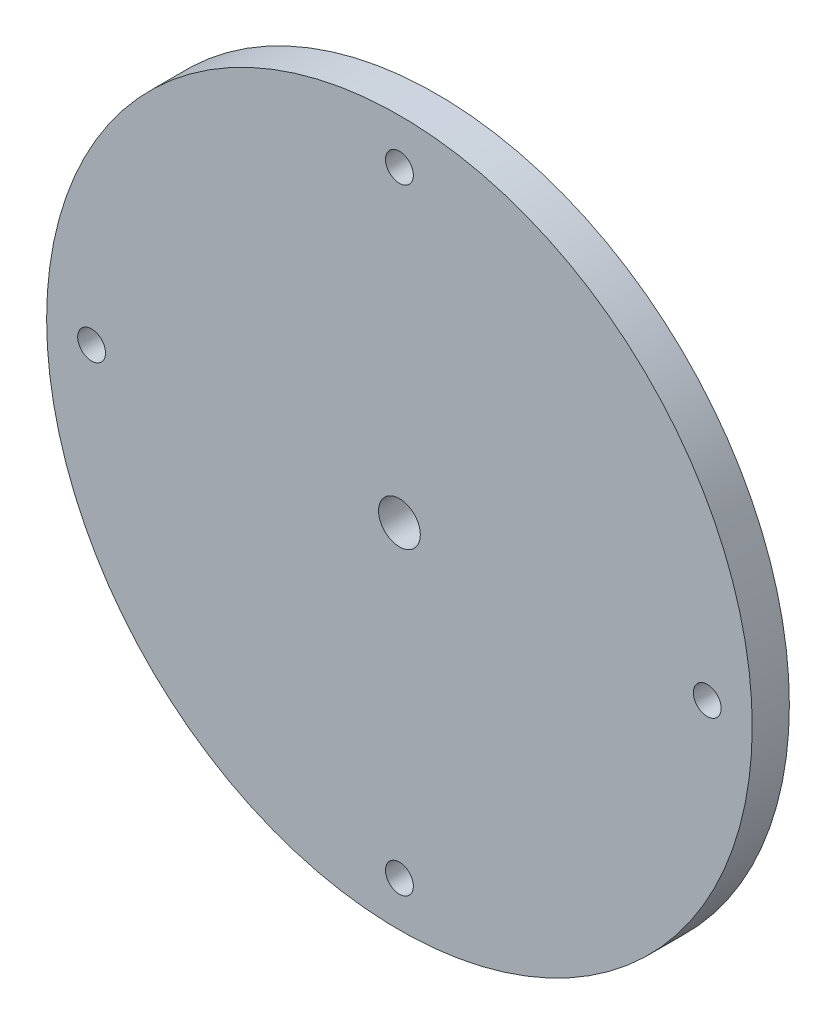
from build123d import *

# Parameters (mm, degrees)
SKETCH2_R           = 76
SKETCH2_R_2         = 3
SKETCH2_R_3         = 4.5
BOSS_EXTRUDE1_DEPTH = 8


with BuildPart() as part:
    # Sketch2 → Boss-Extrude1 (new body)
    with BuildSketch(Plane.XY):
        Circle(SKETCH2_R)
        with Locations((0, 66.31)):
            Circle(SKETCH2_R_2, mode=Mode.SUBTRACT)
        with Locations((0, -66.31)):
            Circle(SKETCH2_R_2, mode=Mode.SUBTRACT)
        with Locations((66.31, 0)):
            Circle(SKETCH2_R_2, mode=Mode.SUBTRACT)
        with Locations((-66.31, 0)):
            Circle(SKETCH2_R_2, mode=Mode.SUBTRACT)
        Circle(SKETCH2_R_3, mode=Mode.SUBTRACT)
    extrude(amount=BOSS_EXTRUDE1_DEPTH)


solid = part.part
